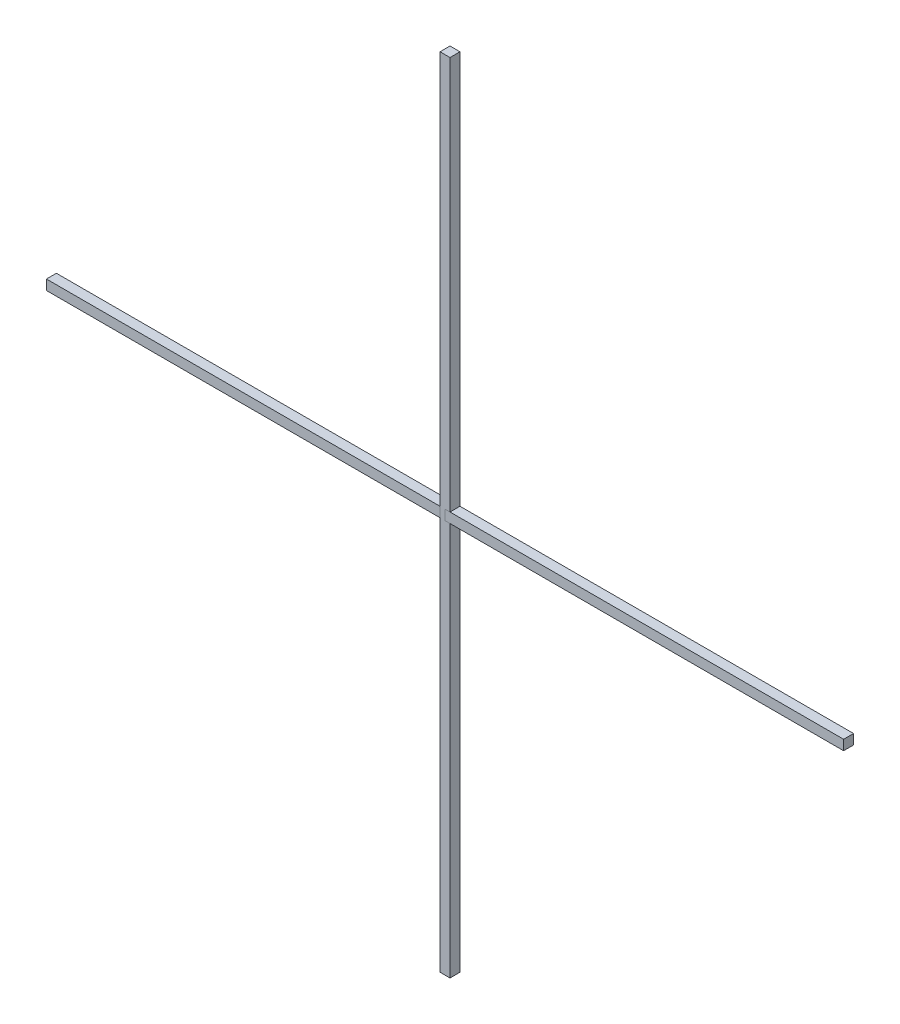
from build123d import *

# Parameters (mm, degrees)
SKETCH11_W               = 125
SKETCH11_H               = 125
STRUCTURAL_MEMBER1_DEPTH = 10000
SKETCH12_W               = 125
SKETCH12_H               = 125
STRUCTURAL_MEMBER2_DEPTH = 10000


with BuildPart() as part:
    # Sketch11 → Structural Member1 (new body)
    with BuildSketch(Plane.YZ.offset(-5000)):
        Rectangle(SKETCH11_W, SKETCH11_H)
    extrude(amount=STRUCTURAL_MEMBER1_DEPTH)


with BuildPart() as body_2:
    # Sketch12 → Structural Member2 (new body)
    with BuildSketch(Plane(origin=(0, -5000, 0), x_dir=(-1, 0, 0), z_dir=(0, 1, 0))):
        Rectangle(SKETCH12_W, SKETCH12_H)
    extrude(amount=STRUCTURAL_MEMBER2_DEPTH)


solid = Compound([part.part, body_2.part])
